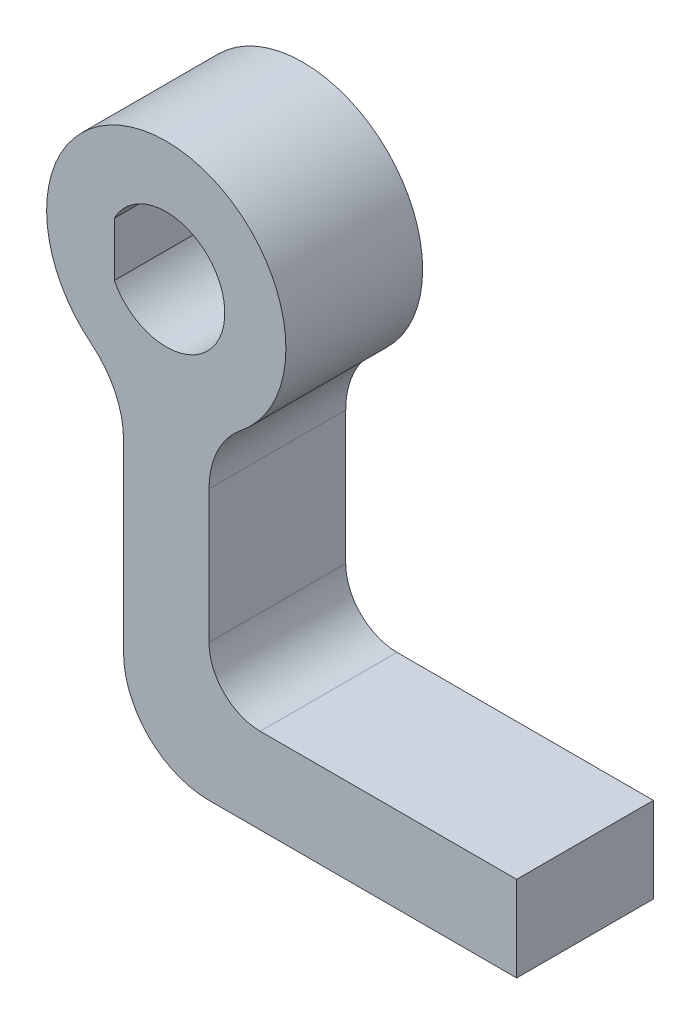
from build123d import *

# Parameters (mm, degrees)
BOSS_EXTRUDE1_DEPTH = 4


with BuildPart() as part:
    # Sketch1 → Boss-Extrude1 (new, symmetric)
    with BuildSketch(Plane.XY):
        with BuildLine():
            Line((-2.5, -9.367496998), (-2.5, -20.15))
            ThreePointArc((-2.5, -20.15), (-1.035533906, -23.685533906), (2.5, -25.15))
            Line((2.5, -25.15), (20.5, -25.15))
            Line((20.5, -25.15), (20.5, -20.15))
            Line((20.5, -20.15), (5.5, -20.15))
            ThreePointArc((5.5, -20.15), (3.378679656, -19.271320344), (2.5, -17.15))
            Line((2.5, -17.15), (2.5, -9.367496998))
            ThreePointArc((2.5, -9.367496998), (2.993060906, -7.202433488), (4.375, -5.464373249))
            ThreePointArc((4.375, -5.464373249), (0, 7), (-4.375, -5.464373249))
            ThreePointArc((-4.375, -5.464373249), (-2.993060906, -7.202433488), (-2.5, -9.367496998))
        make_face()
        with BuildLine():
            Line((-3.04, 1.577664413), (-3.04, -1.577664413))
            ThreePointArc((-3.04, -1.577664413), (3.425, 0), (-3.04, 1.577664413))
        make_face(mode=Mode.SUBTRACT)
    extrude(amount=BOSS_EXTRUDE1_DEPTH, both=True)


solid = part.part
